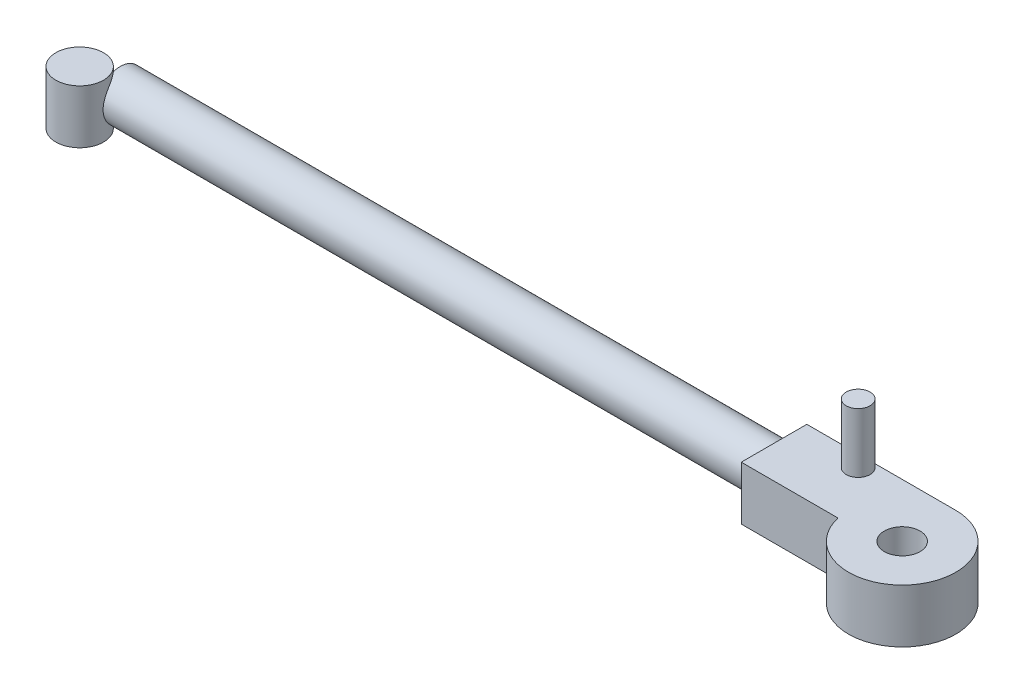
from build123d import *

# Parameters (mm, degrees)
SKETCH1_R           = 9
BOSS_EXTRUDE1_DEPTH = 9
SKETCH2_R           = 3
CUT_EXTRUDE1_DEPTH  = 29.053520278
SKETCH3_R           = 4
BOSS_EXTRUDE2_DEPTH = 9
SKETCH4_R           = 3.852623496
BOSS_EXTRUDE3_DEPTH = 110
SKETCH5_R           = 2
BOSS_EXTRUDE4_DEPTH = 10


with BuildPart() as part:
    # Sketch1 → Boss-Extrude1 (new body)
    with BuildSketch(Plane(origin=(0, 0, 0), x_dir=(1, 0, 0), z_dir=(0, 1, 0))):
        with BuildLine():
            ThreePointArc((-8.774964387, -2), (-7.03562364, 5.61248608), (0, 9))
            Line((0, 9), (-25, 9))
            Line((-25, 9), (-25, -2))
            Line((-25, -2), (-8.774964387, -2))
        make_face()
        Circle(SKETCH1_R)
    extrude(amount=BOSS_EXTRUDE1_DEPTH)

    # Sketch2 → Cut-Extrude1 (cut, through all)
    with BuildSketch(Plane.XZ):
        with Locations(Location((0, 0, 0), (0, 0, 270))):
            Circle(SKETCH2_R)
    extrude(amount=-CUT_EXTRUDE1_DEPTH, mode=Mode.SUBTRACT)



with BuildPart() as body_2:
    # Sketch3 → Boss-Extrude2 (new body)
    with BuildSketch(Plane(origin=(0, 0, 0), x_dir=(1, 0, 0), z_dir=(0, 1, 0))):
        with Locations(Location((-138, 0, 0), (0, 0, 270))):
            Circle(SKETCH3_R)
    extrude(amount=BOSS_EXTRUDE2_DEPTH)


with BuildPart() as part_1:
    add(part.part)

    add(body_2.part)  # Boss-Extrude3 merges body 2
    # Sketch4 → Boss-Extrude3 (add)
    with BuildSketch(Plane.ZY.offset(25)):
        with Locations(Location((-3.784788574, 4.743284234, 0), (0, 0, 180))):
            Circle(SKETCH4_R)
    extrude(amount=BOSS_EXTRUDE3_DEPTH)

    # Sketch5 → Boss-Extrude4 (add)
    with BuildSketch(Plane(origin=(0, 9, 0), x_dir=(1, 0, 0), z_dir=(0, 1, 0))):
        with Locations(Location((-14.38749457, 7, 0), (0, 0, 90))):
            Circle(SKETCH5_R)
    extrude(amount=BOSS_EXTRUDE4_DEPTH)


solid = part_1.part
